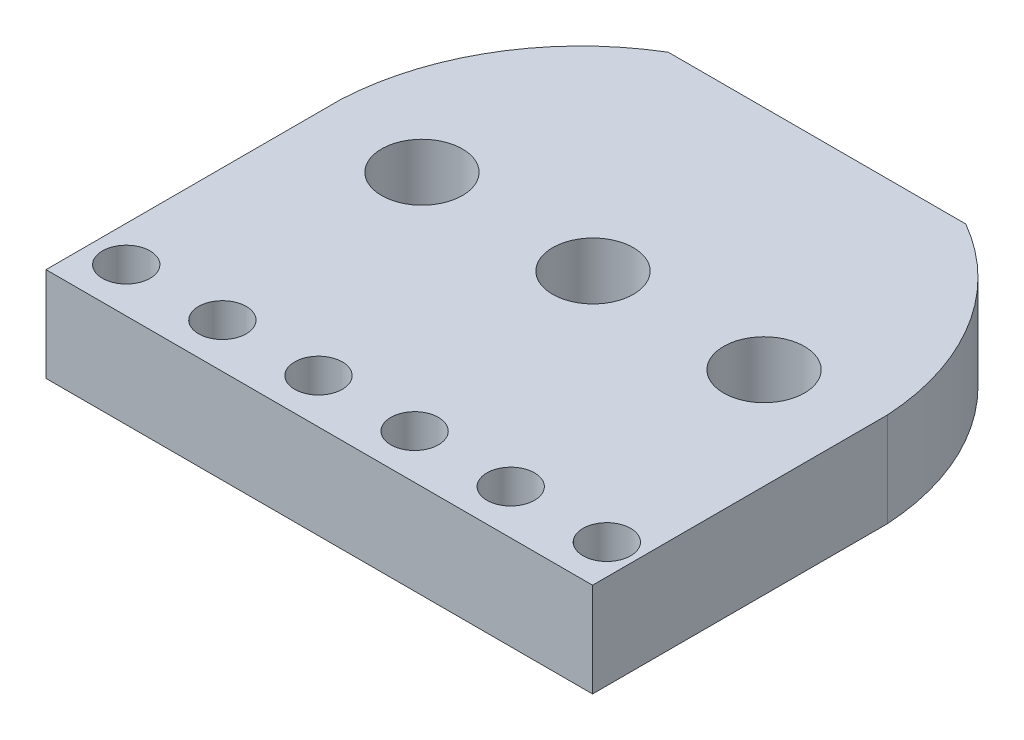
from build123d import *

# Parameters (mm, degrees)
SKETCH1_W           = 11.6
SKETCH1_H           = 10.6
BOSS_EXTRUDE1_DEPTH = 2
SKETCH2_R           = 0.85805849
SKETCH2_R_2         = 0.505403016
CUT_EXTRUDE1_DEPTH  = 9.107404023


with BuildPart() as part:
    # Sketch1 → Boss-Extrude1 (new body)
    with BuildSketch(Plane(origin=(0, 0, 0), x_dir=(1, 0, 0), z_dir=(0, 1, 0))):
        Rectangle(SKETCH1_W, SKETCH1_H)
    extrude(amount=BOSS_EXTRUDE1_DEPTH)

    # Sketch2 → Cut-Extrude1 (cut, through all)
    with BuildSketch(Plane(origin=(0, 2, 0), x_dir=(1, 0, 0), z_dir=(0, 1, 0))):
        with Locations(Location((-3.600453249, 0.480060433, 0), (0, 0, 270))):
            Circle(SKETCH2_R)
        with Locations(Location((0.029546751, 0.480060433, 0), (0, 0, 270))):
            Circle(SKETCH2_R)
        with Locations(Location((3.659546751, 0.480060433, 0), (0, 0, 270))):
            Circle(SKETCH2_R)
        with Locations(Location((-5.040634548, -4.35610393, 0), (0, 0, 270))):
            Circle(SKETCH2_R_2)
        with Locations(Location((-3.000634548, -4.35610393, 0), (0, 0, 270))):
            Circle(SKETCH2_R_2)
        with Locations(Location((-0.960634548, -4.35610393, 0), (0, 0, 270))):
            Circle(SKETCH2_R_2)
        with Locations(Location((1.079365452, -4.35610393, 0), (0, 0, 270))):
            Circle(SKETCH2_R_2)
        with Locations(Location((3.119365452, -4.35610393, 0), (0, 0, 270))):
            Circle(SKETCH2_R_2)
        with Locations(Location((5.159365452, -4.35610393, 0), (0, 0, 270))):
            Circle(SKETCH2_R_2)
        with BuildLine():
            Line((-5.8, 0.960120866), (-5.8, 5.3))
            Line((-5.8, 5.3), (-3.19151288, 5.3))
            ThreePointArc((-3.19151288, 5.3), (-5.039424989, 3.456832761), (-5.8, 0.960120866))
        make_face()
        with BuildLine():
            Line((3.120392815, 5.3), (5.8, 5.3))
            Line((5.8, 5.3), (5.8, 0.960120866))
            ThreePointArc((5.8, 0.960120866), (5.008377062, 3.468528113), (3.120392815, 5.3))
        make_face()
    extrude(amount=-CUT_EXTRUDE1_DEPTH, mode=Mode.SUBTRACT)


solid = part.part
